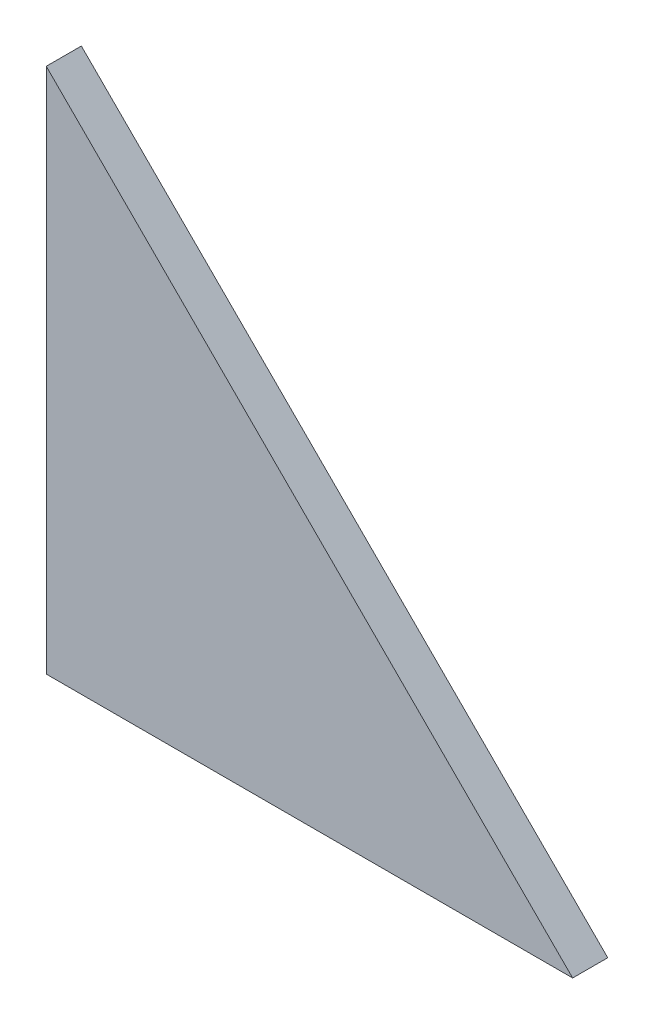
from build123d import *

# Parameters (mm, degrees)
SALIENTE_EXTRUIR1_DEPTH = 10


with BuildPart() as part:
    # Croquis1 → Saliente-Extruir1 (new body)
    with BuildSketch(Plane.XY):
        Polygon((-26.108862104, 126.795794393), (-26.108862104, -23.204205607), (123.891137896, -23.204205607), align=None)
    extrude(amount=SALIENTE_EXTRUIR1_DEPTH)


solid = part.part
